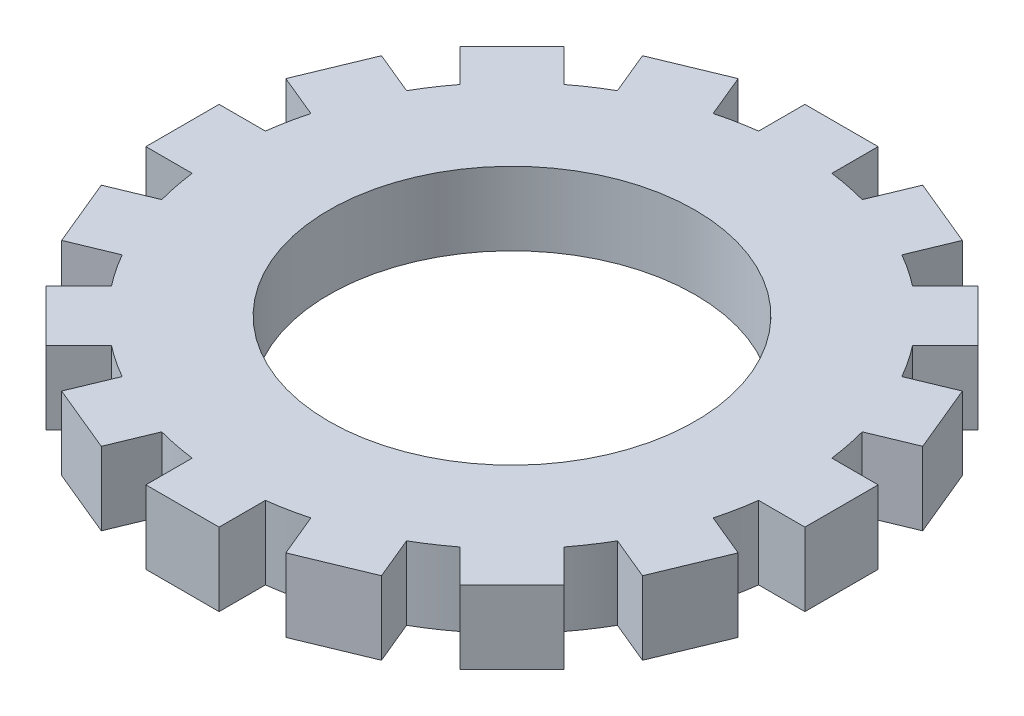
from build123d import *

# Parameters (mm, degrees)
SKETCH1_R           = 25
BOSS_EXTRUDE1_DEPTH = 10


with BuildPart() as part:
    # Sketch1 → Boss-Extrude1 (new body)
    with BuildSketch(Plane(origin=(0, 0, 0), x_dir=(1, 0, 0), z_dir=(0, 1, 0))):
        with BuildLine():
            Line((12.601356794, 43.487996125), (10.182093062, 37.647376813))
            ThreePointArc((10.182093062, 37.647376813), (7.608522559, 38.250625936), (5, 38.678159212))
            Line((5, 38.678159212), (5, 45))
            Line((5, 45), (-5, 45))
            Line((-5, 45), (-5, 38.678159212))
            ThreePointArc((-5, 38.678159212), (-7.608522559, 38.250625936), (-10.182093062, 37.647376813))
            Line((-10.182093062, 37.647376813), (-12.601356794, 43.487996125))
            Line((-12.601356794, 43.487996125), (-21.840152119, 39.661161801))
            Line((-21.840152119, 39.661161801), (-19.420888387, 33.820542489))
            ThreePointArc((-19.420888387, 33.820542489), (-21.667239088, 32.42731488), (-23.814054756, 30.885122568))
            Line((-23.814054756, 30.885122568), (-28.284271247, 35.355339059))
            Line((-28.284271247, 35.355339059), (-35.355339059, 28.284271247))
            Line((-35.355339059, 28.284271247), (-30.885122568, 23.814054756))
            ThreePointArc((-30.885122568, 23.814054756), (-32.42731488, 21.667239088), (-33.820542489, 19.420888387))
            Line((-33.820542489, 19.420888387), (-39.661161801, 21.840152119))
            Line((-39.661161801, 21.840152119), (-43.487996125, 12.601356794))
            Line((-43.487996125, 12.601356794), (-37.647376813, 10.182093062))
            ThreePointArc((-37.647376813, 10.182093062), (-38.250625936, 7.608522559), (-38.678159212, 5))
            Line((-38.678159212, 5), (-45, 5))
            Line((-45, 5), (-45, -5))
            Line((-45, -5), (-38.678159212, -5))
            ThreePointArc((-38.678159212, -5), (-38.250625936, -7.608522559), (-37.647376813, -10.182093062))
            Line((-37.647376813, -10.182093062), (-43.487996125, -12.601356794))
            Line((-43.487996125, -12.601356794), (-39.661161801, -21.840152119))
            Line((-39.661161801, -21.840152119), (-33.820542489, -19.420888387))
            ThreePointArc((-33.820542489, -19.420888387), (-32.42731488, -21.667239088), (-30.885122568, -23.814054756))
            Line((-30.885122568, -23.814054756), (-35.355339059, -28.284271247))
            Line((-35.355339059, -28.284271247), (-28.284271247, -35.355339059))
            Line((-28.284271247, -35.355339059), (-23.814054756, -30.885122568))
            ThreePointArc((-23.814054756, -30.885122568), (-21.667239088, -32.42731488), (-19.420888387, -33.820542489))
            Line((-19.420888387, -33.820542489), (-21.840152119, -39.661161801))
            Line((-21.840152119, -39.661161801), (-12.601356794, -43.487996125))
            Line((-12.601356794, -43.487996125), (-10.182093062, -37.647376813))
            ThreePointArc((-10.182093062, -37.647376813), (-7.608522559, -38.250625936), (-5, -38.678159212))
            Line((-5, -38.678159212), (-5, -45))
            Line((-5, -45), (5, -45))
            Line((5, -45), (5, -38.678159212))
            ThreePointArc((5, -38.678159212), (7.608522559, -38.250625936), (10.182093062, -37.647376813))
            Line((10.182093062, -37.647376813), (12.601356794, -43.487996125))
            Line((12.601356794, -43.487996125), (21.840152119, -39.661161801))
            Line((21.840152119, -39.661161801), (19.420888387, -33.820542489))
            ThreePointArc((19.420888387, -33.820542489), (21.667239088, -32.42731488), (23.814054756, -30.885122568))
            Line((23.814054756, -30.885122568), (28.284271247, -35.355339059))
            Line((28.284271247, -35.355339059), (35.355339059, -28.284271247))
            Line((35.355339059, -28.284271247), (30.885122568, -23.814054756))
            ThreePointArc((30.885122568, -23.814054756), (32.42731488, -21.667239088), (33.820542489, -19.420888387))
            Line((33.820542489, -19.420888387), (39.661161801, -21.840152119))
            Line((39.661161801, -21.840152119), (43.487996125, -12.601356794))
            Line((43.487996125, -12.601356794), (37.647376813, -10.182093062))
            ThreePointArc((37.647376813, -10.182093062), (38.250625936, -7.608522559), (38.678159212, -5))
            Line((38.678159212, -5), (45, -5))
            Line((45, -5), (45, 5))
            Line((45, 5), (38.678159212, 5))
            ThreePointArc((38.678159212, 5), (38.250625936, 7.608522559), (37.647376813, 10.182093062))
            Line((37.647376813, 10.182093062), (43.487996125, 12.601356794))
            Line((43.487996125, 12.601356794), (39.661161801, 21.840152119))
            Line((39.661161801, 21.840152119), (33.820542489, 19.420888387))
            ThreePointArc((33.820542489, 19.420888387), (32.42731488, 21.667239088), (30.885122568, 23.814054756))
            Line((30.885122568, 23.814054756), (35.355339059, 28.284271247))
            Line((35.355339059, 28.284271247), (28.284271247, 35.355339059))
            Line((28.284271247, 35.355339059), (23.814054756, 30.885122568))
            ThreePointArc((23.814054756, 30.885122568), (21.667239088, 32.42731488), (19.420888387, 33.820542489))
            Line((19.420888387, 33.820542489), (21.840152119, 39.661161801))
            Line((21.840152119, 39.661161801), (12.601356794, 43.487996125))
        make_face()
        with Locations(Location((0, 0, 0), (0, 0, 270))):
            Circle(SKETCH1_R, mode=Mode.SUBTRACT)
    extrude(amount=BOSS_EXTRUDE1_DEPTH)


solid = part.part
